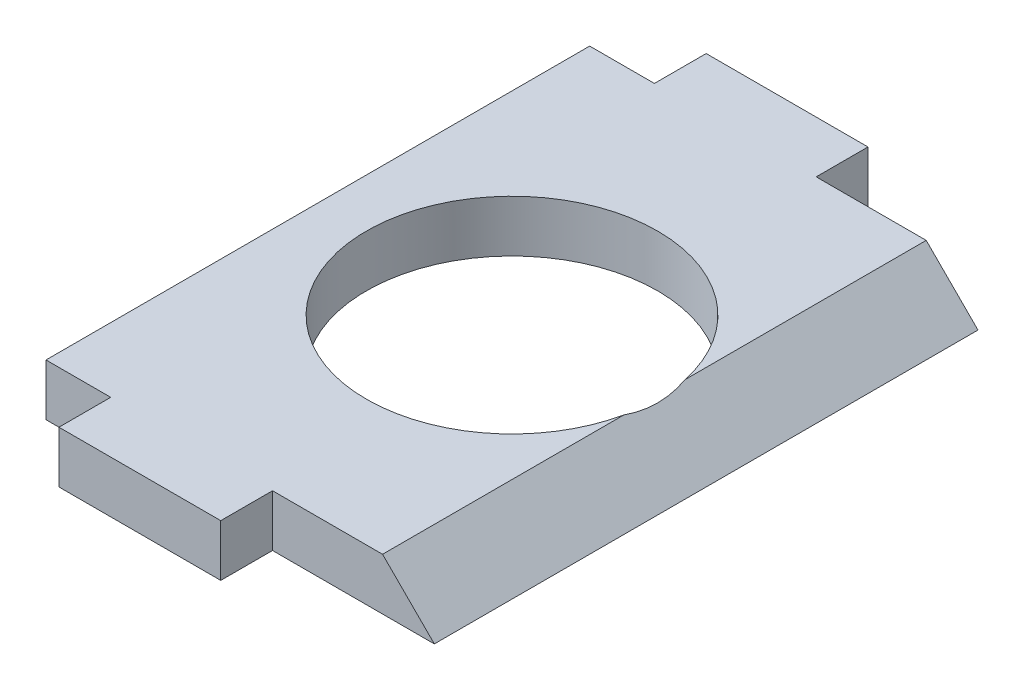
from build123d import *

# Parameters (mm, degrees)
SKETCH1_R           = 22.5
BOSS_EXTRUDE1_DEPTH = 8
CUT_EXTRUDE4_DEPTH  = 111.127199183


with BuildPart() as part:
    # Sketch1 → Boss-Extrude1 (new body)
    with BuildSketch(Plane(origin=(0, 0, 0), x_dir=(1, 0, 0), z_dir=(0, 1, 0))):
        Polygon((10, 0), (35, 0), (35, 8), (60, 8), (60, 92), (35, 92), (35, 100), (10, 100), (10, 92), (0, 92), (0, 8), (10, 8), align=None)
        with Locations(Location((30, 50, 0), (0, 0, 270))):
            Circle(SKETCH1_R, mode=Mode.SUBTRACT)
    extrude(amount=BOSS_EXTRUDE1_DEPTH)

    # Sketch7 → Cut-Extrude4 (cut, through all)
    with BuildSketch(Plane.XY.offset(-8)):
        Polygon((60, 0), (52, 8), (60, 8), align=None)
    extrude(amount=-CUT_EXTRUDE4_DEPTH, mode=Mode.SUBTRACT)


solid = part.part
